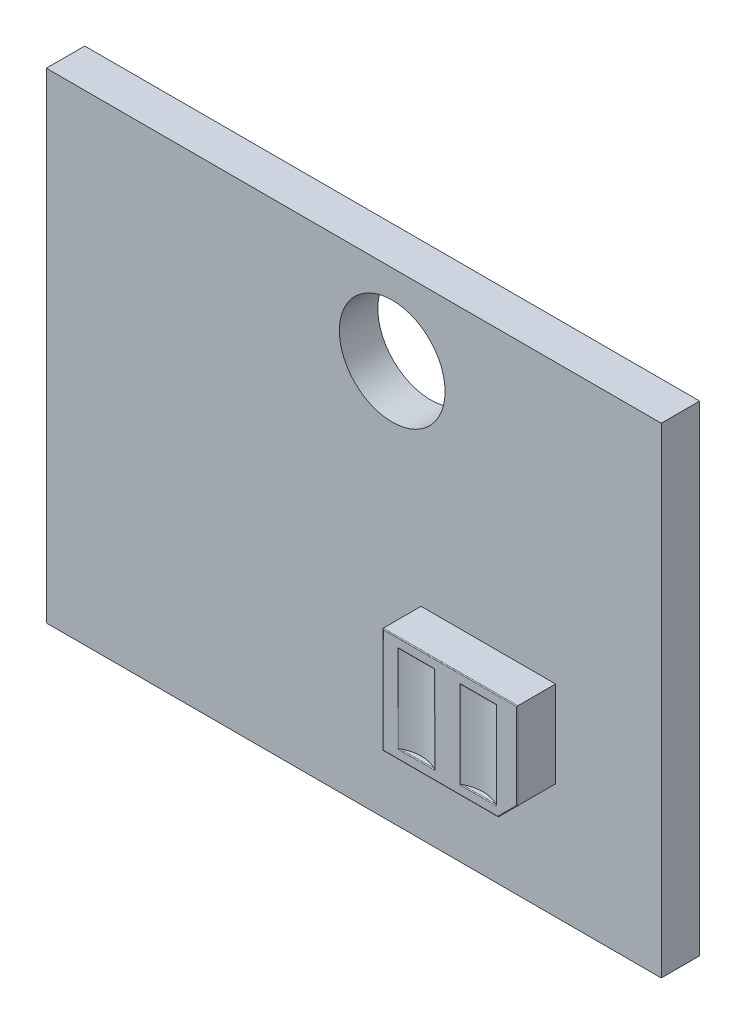
from build123d import *

# Parameters (mm, degrees)
ESQUISSE1_W             = 16
ESQUISSE1_H             = 12.5
ESQUISSE1_R             = 1.375
EXTRUSION1_DEPTH        = 1
EXTRUSION2_DEPTH        = 2
ENL_V_MAT_EXTRU_1_DEPTH = 2.25
CONG_1_R                = 0.02


with BuildPart() as part:
    # Esquisse1 → Extrusion1 (new body)
    with BuildSketch(Plane.XY):
        with Locations((-0.25, 0)):
            Rectangle(ESQUISSE1_W, ESQUISSE1_H)
        with Locations((0.75, 4.15)):
            Circle(ESQUISSE1_R, mode=Mode.SUBTRACT)
    extrude(amount=EXTRUSION1_DEPTH)

    # Esquisse3 → Extrusion2 (add)
    with BuildSketch(Plane.XY):
        Polygon((1.5, -1), (5, -1), (5, -3.25), (4.5, -3.75), (1.5, -3.75), align=None)
    extrude(amount=EXTRUSION2_DEPTH)

    # Esquisse4 → Enlèv. mat.-Extru.1 (cut)
    with BuildSketch(Plane.XZ.offset(3.5)):
        with BuildLine():
            Line((1.905461948, 2), (2.855665367, 2))
            ThreePointArc((2.855665367, 2), (2.380563657, 1.872882694), (1.905461948, 2))
        make_face()
        with BuildLine():
            Line((4.463762682, 2), (3.513559263, 2))
            ThreePointArc((3.513559263, 2), (3.988660973, 1.872882694), (4.463762682, 2))
        make_face()
    extrude(amount=-ENL_V_MAT_EXTRU_1_DEPTH, mode=Mode.SUBTRACT)

    # Congé1
    cong_1_edges = [part.edges().sort_by_distance(p)[0] for p in [
        (3.25, -1, 2),
        (5, -2.125, 2),
        (4.75, -3.5, 2),
        (3, -3.75, 2),
        (1.5, -2.375, 2),
        (3.988660973, -3.5, 2),
        (3.513559263, -2.375, 2),
        (3.988660973, -1.25, 2),
        (4.463762682, -2.375, 2),
        (1.905461948, -2.375, 2),
        (2.380563657, -1.25, 2),
        (2.855665367, -2.375, 2),
        (2.380563657, -3.5, 2),
    ]]
    fillet(cong_1_edges, radius=CONG_1_R)


solid = part.part
